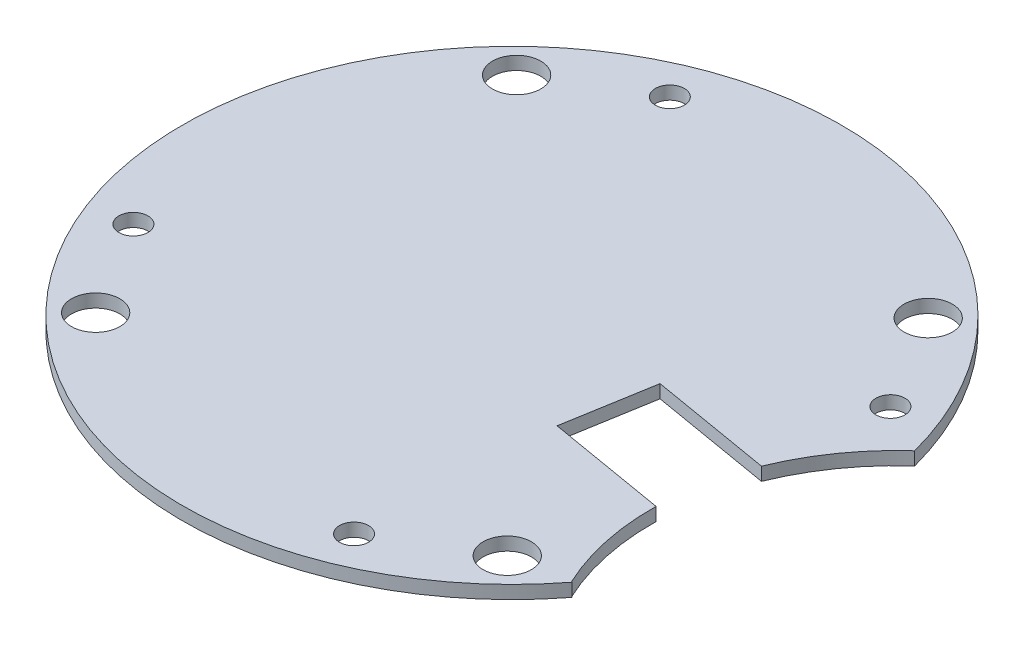
from build123d import *

# Parameters (mm, degrees)
SKETCH1_R           = 37.5
BOSS_EXTRUDE1_DEPTH = 1.5
SKETCH4_R           = 7.25
BOSS_EXTRUDE2_DEPTH = 6
SKETCH5_R           = 5.5
CUT_EXTRUDE2_DEPTH  = 7
SKETCH8_R           = 2.75
SKETCH8_R_2         = 1.65
CUT_EXTRUDE3_DEPTH  = 10
CUT_EXTRUDE5_DEPTH  = 5


with BuildPart() as part:
    # Sketch1 → Boss-Extrude1 (new body)
    with BuildSketch(Plane(origin=(0, 0, 0), x_dir=(1, 0, 0), z_dir=(0, 1, 0))):
        with Locations(Location((0, 0, 0), (0, 0, 270))):
            Circle(SKETCH1_R)
    extrude(amount=BOSS_EXTRUDE1_DEPTH)

    # Sketch4 → Boss-Extrude2 (add)
    with BuildSketch(Plane.XZ):
        with Locations(Location((0, 0, 0), (0, 0, 270))):
            Circle(SKETCH4_R)
    extrude(amount=BOSS_EXTRUDE2_DEPTH)

    # Sketch5 → Cut-Extrude2 (cut)
    with BuildSketch(Plane.XZ.offset(6)):
        with Locations(Location((0, 0, 0), (0, 0, 270))):
            Circle(SKETCH5_R)
    extrude(amount=-CUT_EXTRUDE2_DEPTH, mode=Mode.SUBTRACT)

    # Sketch8 → Cut-Extrude3 (cut)
    with BuildSketch(Plane(origin=(0, 1.5, 0), x_dir=(1, 0, 0), z_dir=(0, 1, 0))):
        with Locations(Location((-23.416394486, 23.949580961, 0), (0, 0, 270))):
            Circle(SKETCH8_R)
        with Locations(Location((23.949580961, 23.416394486, 0), (0, 0, 270))):
            Circle(SKETCH8_R)
        with Locations(Location((23.416394486, -23.949580961, 0), (0, 0, 270))):
            Circle(SKETCH8_R)
        with Locations(Location((-23.949580961, -23.416394486, 0), (0, 0, 270))):
            Circle(SKETCH8_R)
        with Locations(Location((-30.519872414, -12.551389877, 0), (0, 0, 270))):
            Circle(SKETCH8_R_2)
        with Locations(Location((-12.551389877, 30.519872414, 0), (0, 0, 270))):
            Circle(SKETCH8_R_2)
        with Locations(Location((30.519872414, 12.551389878, 0), (0, 0, 270))):
            Circle(SKETCH8_R_2)
        with Locations(Location((12.551389878, -30.519872414, 0), (0, 0, 270))):
            Circle(SKETCH8_R_2)
    extrude(amount=-CUT_EXTRUDE3_DEPTH, mode=Mode.SUBTRACT)

    # Sketch9 → Cut-Extrude5 (cut, symmetric)
    with BuildSketch(Plane(origin=(0, 1.5, 0), x_dir=(1, 0, 0), z_dir=(0, 1, 0))):
        with BuildLine():
            Line((15.152911059, 1.700080088), (13.450685177, -8.316302683))
            Line((13.450685177, -8.316302683), (27.023681414, -10.622954298))
            ThreePointArc((27.023681414, -10.622954298), (27.636041802, -16.917145139), (29.657895546, -22.909134042))
            ThreePointArc((29.657895546, -22.909134042), (42.084378473, -8.529589687), (36.242968745, 9.555395969))
            ThreePointArc((36.242968745, 9.555395969), (32.067942495, 4.855826196), (29.0581189, -0.663028953))
            Line((29.0581189, -0.663028953), (15.152911059, 1.700080088))
        make_face()
    extrude(amount=CUT_EXTRUDE5_DEPTH, both=True, mode=Mode.SUBTRACT)


solid = part.part
